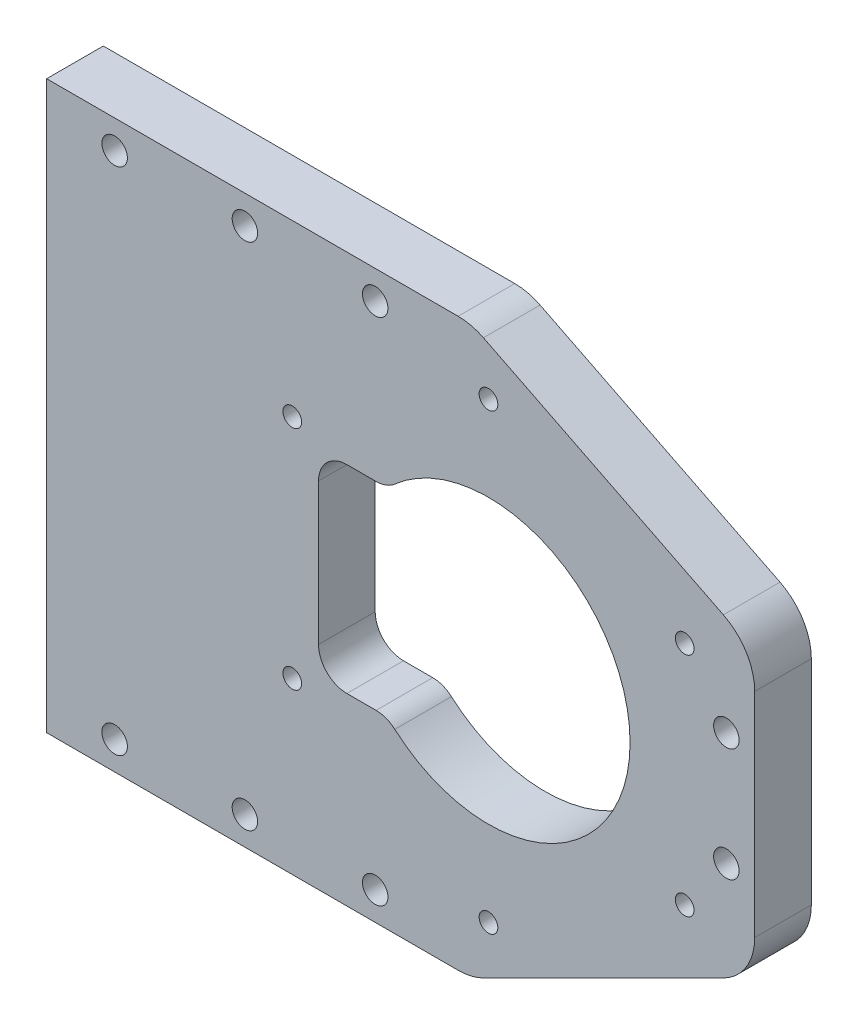
from build123d import *

# Parameters (mm, degrees)
EXTRUDE1_DEPTH                                  = 10
CUT_EXTRUDE1_DEPTH                              = 20
SKETCH3_R                                       = 1.65
CUT_EXTRUDE2_DEPTH                              = 10
SKETCH4_R                                       = 1.65
CUT_EXTRUDE3_DEPTH                              = 15
FILLET1_R                                       = 10
FILLET3_R                                       = 5
SKETCH7_R                                       = 1.5
CUT_EXTRUDE4_DEPTH                              = 10
CSK_FOR_M4_FLAT_HEAD_MACHINE_SCREW2_D           = 4.5
CSK_FOR_M4_FLAT_HEAD_MACHINE_SCREW2_CSINK_D     = 9.4
CSK_FOR_M4_FLAT_HEAD_MACHINE_SCREW2_CSINK_ANGLE = 90
SKETCH10_R                                      = 2.25
CUT_EXTRUDE5_DEPTH                              = 10
CSK_FOR_M4_FLAT_HEAD_MACHINE_SCREW3_D           = 4.5
CSK_FOR_M4_FLAT_HEAD_MACHINE_SCREW3_CSINK_D     = 9.4
CSK_FOR_M4_FLAT_HEAD_MACHINE_SCREW3_CSINK_ANGLE = 90


with BuildPart() as part:
    # Sketch1 → Extrude1 (new body)
    with BuildSketch(Plane.XY):
        Polygon((0, -50), (75, -50), (125, -25), (125, 25), (75, 50), (0, 50), align=None)
    extrude(amount=EXTRUDE1_DEPTH)

    # Sketch2 → Cut-Extrude1 (cut)
    with BuildSketch(Plane.XY.offset(10)):
        with BuildLine():
            Line((60.146428929, -17.5), (48, -17.5))
            Line((48, -17.5), (48, 17.5))
            Line((48, 17.5), (60.146428929, 17.5))
            ThreePointArc((60.146428929, 17.5), (103, 0), (60.146428929, -17.5))
        make_face()
    extrude(amount=-CUT_EXTRUDE1_DEPTH, mode=Mode.SUBTRACT)

    # Sketch3 → Cut-Extrude2 (cut)
    with BuildSketch(Plane(origin=(0, 0, 0), x_dir=(-1, 0, 0), z_dir=(0, 0, -1))):
        with Locations((-112.641016151, 20)):
            Circle(SKETCH3_R)
        with Locations((-78, 40)):
            Circle(SKETCH3_R)
        with Locations((-43.358983849, 20)):
            Circle(SKETCH3_R)
        with Locations((-43.358983849, -20)):
            Circle(SKETCH3_R)
        with Locations((-78, -40)):
            Circle(SKETCH3_R)
        with Locations((-112.641016151, -20)):
            Circle(SKETCH3_R)
    extrude(amount=-CUT_EXTRUDE2_DEPTH, mode=Mode.SUBTRACT)

    # Sketch4 → Cut-Extrude3 (cut)
    with BuildSketch(Plane.ZY):
        with Locations((5, -37.5)):
            Circle(SKETCH4_R)
        with Locations((5, -12.5)):
            Circle(SKETCH4_R)
        with Locations(Location((5, 12.5, 0), (0, 0, 180))):
            Circle(SKETCH4_R)
        with Locations(Location((5, 37.5, 0), (0, 0, 180))):
            Circle(SKETCH4_R)
    extrude(amount=-CUT_EXTRUDE3_DEPTH, mode=Mode.SUBTRACT)

    # Fillet1
    fillet1_edges = [part.edges().sort_by_distance(p)[0] for p in [
        (75, 50, 5),
        (125, 25, 5),
        (125, -25, 5),
        (75, -50, 5),
    ]]
    fillet(fillet1_edges, radius=FILLET1_R)

    # Fillet3
    fillet3_edges = [part.edges().sort_by_distance(p)[0] for p in [
        (60.146428929, 17.5, 5),
        (60.146428929, -17.5, 5),
        (48, -17.5, 5),
        (48, 17.5, 5),
    ]]
    fillet(fillet3_edges, radius=FILLET3_R)

    # Sketch7 → Cut-Extrude4 (cut)
    with BuildSketch(Plane(origin=(0, 0, 0), x_dir=(-1, 0, 0), z_dir=(0, 0, -1))):
        with Locations((-35, -45)):
            Circle(SKETCH7_R)
        with Locations((-12, -45)):
            Circle(SKETCH7_R)
        with Locations(Location((-58, -45, 0), (0, 0, 180))):
            Circle(SKETCH7_R)
        with Locations(Location((-35, 45, 0), (0, 0, 180))):
            Circle(SKETCH7_R)
        with Locations((-58, 45)):
            Circle(SKETCH7_R)
        with Locations(Location((-12, 45, 0), (0, 0, 180))):
            Circle(SKETCH7_R)
    extrude(amount=-CUT_EXTRUDE4_DEPTH, mode=Mode.SUBTRACT)

    # CSK for M4 Flat Head Machine Screw2 (through all)
    with Locations(Plane(origin=(0, 0, 0), x_dir=(-1, 0, 0), z_dir=(0, 0, -1))):
        with Locations((-58, -45), (-35, -45), (-12, -45), (-58, 45), (-35, 45), (-12, 45)):
            CounterSinkHole(CSK_FOR_M4_FLAT_HEAD_MACHINE_SCREW2_D / 2, CSK_FOR_M4_FLAT_HEAD_MACHINE_SCREW2_CSINK_D / 2, counter_sink_angle=CSK_FOR_M4_FLAT_HEAD_MACHINE_SCREW2_CSINK_ANGLE)

    # Sketch10 → Cut-Extrude5 (cut)
    with BuildSketch(Plane(origin=(0, 0, 0), x_dir=(-1, 0, 0), z_dir=(0, 0, -1))):
        with Locations((-120, -10)):
            Circle(SKETCH10_R)
        with Locations(Location((-120, 10, 0), (0, 0, 180))):
            Circle(SKETCH10_R)
    extrude(amount=-CUT_EXTRUDE5_DEPTH, mode=Mode.SUBTRACT)

    # CSK for M4 Flat Head Machine Screw3 (through all)
    with Locations(Plane(origin=(0, 0, 0), x_dir=(-1, 0, 0), z_dir=(0, 0, -1))):
        with Locations((-120, -10), (-120, 10)):
            CounterSinkHole(CSK_FOR_M4_FLAT_HEAD_MACHINE_SCREW3_D / 2, CSK_FOR_M4_FLAT_HEAD_MACHINE_SCREW3_CSINK_D / 2, counter_sink_angle=CSK_FOR_M4_FLAT_HEAD_MACHINE_SCREW3_CSINK_ANGLE)


solid = part.part
